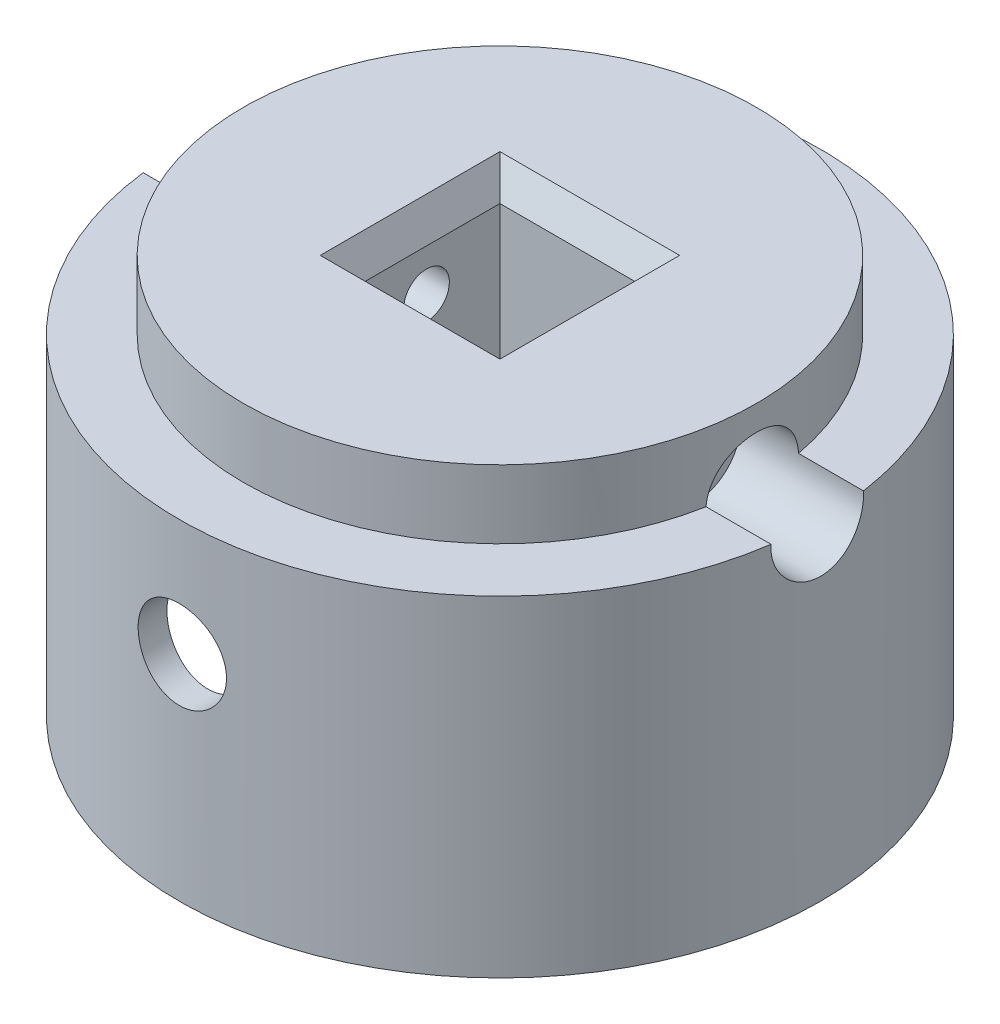
from build123d import *
from OCP.BRepFilletAPI import BRepFilletAPI_MakeChamfer

# Parameters (mm, degrees)
SKETCH1_R                = 22.5
BOSS_EXTRUDE1_DEPTH      = 28
SKETCH2_W                = 10.3
SKETCH2_H                = 10.3
CUT_EXTRUDE2_DEPTH       = 43.385138905
SHELL3_T                 = -2
SKETCH3_R                = 3.1
CUT_EXTRUDE3_DEPTH       = 47.576523056
CHAMFER1_SIZE            = 2
CHAMFER1_SIZE2           = 1.154700538
BOSS_EXTRUDE8_START      = 23
BOSS_EXTRUDE8_DEPTH      = 23
BOSS_EXTRUDE4_DEPTH      = 20
BOSS_EXTRUDE6_DEPTH      = 26
CUT_EXTRUDE5_DEPTH       = 10
SKETCH13_R               = 3.8
CUT_EXTRUDE6_DEPTH       = 16
SKETCH15_W               = 10
SKETCH15_H               = 3
CUT_EXTRUDE8_DEPTH       = 16
CUT_EXTRUDE9_DEPTH       = 2
BOSS_EXTRUDE10_START     = 7
BOSS_EXTRUDE10_DEPTH     = 7
SKETCH21_OUTSIDE_W       = 61.262
SKETCH21_OUTSIDE_H       = 63.966
SKETCH21_OUTSIDE_R       = 18
CUT_EXTRUDE11_DEPTH      = 4.8
CUT_EXTRUDE12_DEPTH      = 47.730672242
CUT_EXTRUDE12_DEPTH_BACK = 47.730672242
SKETCH22_R               = 1.6
CUT_EXTRUDE13_START      = -8.5
SKETCH24_R               = 3.25
CUT_EXTRUDE13_DEPTH      = 39.230672302
CUT_EXTRUDE14_START      = -8.5
CUT_EXTRUDE14_DEPTH      = 39.230672304


with BuildPart() as part:
    # Sketch1 → Boss-Extrude1 (new body)
    with BuildSketch(Plane(origin=(0, 0, 0), x_dir=(1, 0, 0), z_dir=(0, 1, 0))):
        with Locations(Location((0, 0, 0), (0, 0, 270))):
            Circle(SKETCH1_R)
    extrude(amount=BOSS_EXTRUDE1_DEPTH)

    # Sketch2 → Cut-Extrude2 (cut, through all)
    with BuildSketch(Plane.XZ):
        Rectangle(SKETCH2_W, SKETCH2_H)
    extrude(amount=-CUT_EXTRUDE2_DEPTH, mode=Mode.SUBTRACT)

    # Shell3
    shell3_openings = [part.faces().sort_by_distance(p)[0] for p in [
        (0, 0, -21.863603897),
    ]]
    offset(amount=SHELL3_T, openings=shell3_openings, kind=Kind.INTERSECTION)

    # Sketch3 → Cut-Extrude3 (cut, through all)
    with BuildSketch(Plane.XY.offset(7.15)):
        with Locations(Location((0, 15, 0), (0, 0, 270.000000016))):
            Circle(SKETCH3_R)
    extrude(amount=CUT_EXTRUDE3_DEPTH, mode=Mode.SUBTRACT)

    # Chamfer1: one chamfer whose edges measure the first distance from different faces: ONE call of the kernel's chamfer builder (chamfer() names one face for all edges)
    chamfer1_edges_1 = [part.edges().sort_by_distance(p)[0] for p in [
        (5.15, 28, 0),
    ]]
    chamfer1_side_1 = [part.faces().sort_by_distance(p)[0] for p in [
        (5.15, 14, 0),
    ]]
    chamfer1_edges_2 = [part.edges().sort_by_distance(p)[0] for p in [
        (0, 28, -5.15),
    ]]
    chamfer1_side_2 = [part.faces().sort_by_distance(p)[0] for p in [
        (0, 14, -5.15),
    ]]
    chamfer1_edges_3 = [part.edges().sort_by_distance(p)[0] for p in [
        (-5.15, 28, 0),
    ]]
    chamfer1_side_3 = [part.faces().sort_by_distance(p)[0] for p in [
        (-5.15, 14, 0),
    ]]
    chamfer1_edges_4 = [part.edges().sort_by_distance(p)[0] for p in [
        (0, 28, 5.15),
    ]]
    chamfer1_side_4 = [part.faces().sort_by_distance(p)[0] for p in [
        (0, 14, 5.15),
    ]]
    chamfer1 = BRepFilletAPI_MakeChamfer(part.part.solid().wrapped)
    for e in chamfer1_edges_1:
        chamfer1.Add(CHAMFER1_SIZE, CHAMFER1_SIZE2, e.wrapped, chamfer1_side_1[0].wrapped)  # the first distance lies on this face
    for e in chamfer1_edges_2:
        chamfer1.Add(CHAMFER1_SIZE, CHAMFER1_SIZE2, e.wrapped, chamfer1_side_2[0].wrapped)  # the first distance lies on this face
    for e in chamfer1_edges_3:
        chamfer1.Add(CHAMFER1_SIZE, CHAMFER1_SIZE2, e.wrapped, chamfer1_side_3[0].wrapped)  # the first distance lies on this face
    for e in chamfer1_edges_4:
        chamfer1.Add(CHAMFER1_SIZE, CHAMFER1_SIZE2, e.wrapped, chamfer1_side_4[0].wrapped)  # the first distance lies on this face
    add(Compound.cast(chamfer1.Shape()), mode=Mode.REPLACE)

    # Sketch18 → Boss-Extrude8 (add)
    with BuildSketch(Plane.XZ.offset(-26).offset(BOSS_EXTRUDE8_START)):
        with BuildLine():
            Line((-15.72889581, -7.671495069), (-18.425277949, -8.986608509))
            ThreePointArc((-18.425277949, -8.986608509), (-20.471905462, 1.072887103), (-17.384985971, 10.863344917))
            Line((-17.384985971, 10.863344917), (-14.840841683, 9.273587124))
            ThreePointArc((-14.840841683, 9.273587124), (-17.476016858, 0.915879234), (-15.72889581, -7.671495069))
        make_face()
    extrude(amount=-BOSS_EXTRUDE8_DEPTH)

    # Sketch9 → Boss-Extrude4 (add)
    with BuildSketch(Plane.XZ):
        Polygon((2.057061598, -22.405769292), (-16.596699733, -15.192088664), (-17.678751827, -17.990152864), (0.975009504, -25.203833492), align=None)
    extrude(amount=-BOSS_EXTRUDE4_DEPTH)

    # Sketch11 → Boss-Extrude6 (add)
    with BuildSketch(Plane.XZ):
        with BuildLine():
            Line((2.057061598, -22.405769292), (7.15, -7.15))
            Line((7.15, -7.15), (-7.15, -7.15))
            Line((-7.15, -7.15), (-16.596699733, -15.192088664))
            ThreePointArc((-16.596699733, -15.192088664), (-8.115390707, -20.985481497), (2.057061598, -22.405769292))
        make_face()
    extrude(amount=-BOSS_EXTRUDE6_DEPTH)

    # Sketch12 → Cut-Extrude5 (cut)
    with BuildSketch(Plane.XZ):
        with BuildLine():
            Line((3.835926277, -17.077224747), (2.755377072, -20.3139828))
            ThreePointArc((2.755377072, -20.3139828), (-6.94485615, -19.287793369), (-15.072724539, -13.894710323))
            Line((-15.072724539, -13.894710323), (-12.788386178, -11.950025708))
            ThreePointArc((-12.788386178, -11.950025708), (-5.15835992, -16.725347781), (3.835926277, -17.077224747))
        make_face()
    extrude(amount=-CUT_EXTRUDE5_DEPTH, mode=Mode.SUBTRACT)

    # Sketch13 → Cut-Extrude6 (cut)
    with BuildSketch(Plane(origin=(-8.351871161, 0, -21.596993178), x_dir=(-0.9326880665539258, 0, 0.3606840314013081), z_dir=(-0.3606840314013081, 0, -0.9326880665539258))):
        with Locations((0, 10)):
            Circle(SKETCH13_R)
    extrude(amount=-CUT_EXTRUDE6_DEPTH, mode=Mode.SUBTRACT)

    # Sketch15 → Cut-Extrude8 (cut)
    with BuildSketch(Plane(origin=(-8.351871161, 0, -21.596993178), x_dir=(-0.9326880665539258, 0, 0.3606840314013081), z_dir=(-0.3606840314013081, 0, -0.9326880665539258))):
        with Locations((0, 10)):
            Rectangle(SKETCH15_W, SKETCH15_H)
    extrude(amount=-CUT_EXTRUDE8_DEPTH, mode=Mode.SUBTRACT)

    # Sketch17 → Cut-Extrude9 (cut)
    with BuildSketch(Plane.XZ):
        with BuildLine():
            Line((7.15, 7.15), (7.15, -7.15))
            Line((7.15, -7.15), (3.835926277, -17.077224747))
            ThreePointArc((3.835926277, -17.077224747), (-5.15835992, -16.725347781), (-12.788386178, -11.950025708))
            Line((-12.788386178, -11.950025708), (-7.15, -7.15))
            Line((-7.15, -7.15), (-7.15, 7.15))
            Line((-7.15, 7.15), (7.15, 7.15))
        make_face()
    extrude(amount=-CUT_EXTRUDE9_DEPTH, mode=Mode.SUBTRACT)

    # Sketch20 → Boss-Extrude10 (add)
    with BuildSketch(Plane.XZ.offset(-26).offset(BOSS_EXTRUDE10_START)):
        with BuildLine():
            Line((2.755377072, -20.3139828), (7.15, -7.15))
            Line((7.15, -7.15), (7.15, 7.15))
            Line((7.15, 7.15), (-7.15, 7.15))
            Line((-7.15, 7.15), (-7.15, -7.15))
            Line((-7.15, -7.15), (-15.072724539, -13.894710323))
            ThreePointArc((-15.072724539, -13.894710323), (6.94485615, 19.287793369), (2.755377072, -20.3139828))
        make_face()
    extrude(amount=-BOSS_EXTRUDE10_DEPTH)

    # Sketch21 outside → Cut-Extrude11 (cut)
    with BuildSketch(Plane(origin=(0, 28, 0), x_dir=(1, 0, 0), z_dir=(0, 1, 0))):
        with Locations((0, 1.352)):
            Rectangle(SKETCH21_OUTSIDE_W, SKETCH21_OUTSIDE_H)
        with Locations(Location((0, 0, 0), (0, 0, 270))):
            Circle(SKETCH21_OUTSIDE_R, mode=Mode.SUBTRACT)
    extrude(amount=-CUT_EXTRUDE11_DEPTH, mode=Mode.SUBTRACT)

    # Sketch22 → Cut-Extrude12 (cut, two sides: drawn at the far end of the back side and taken through both)
    with BuildSketch(Plane.ZY.offset(-5.15).offset(-CUT_EXTRUDE12_DEPTH_BACK)):
        with Locations((0, 23)):
            Circle(SKETCH22_R)
    extrude(amount=CUT_EXTRUDE12_DEPTH + CUT_EXTRUDE12_DEPTH_BACK, mode=Mode.SUBTRACT)

    # Sketch24 → Cut-Extrude13 (cut, through all)
    with BuildSketch(Plane.ZY.offset(-5.15).offset(CUT_EXTRUDE13_START)):
        with Locations((0, 23)):
            Circle(SKETCH24_R)
    extrude(amount=-CUT_EXTRUDE13_DEPTH, mode=Mode.SUBTRACT)

    # Sketch25 → Cut-Extrude14 (cut, through all)
    with BuildSketch(Plane(origin=(-5.15, 0, 0), x_dir=(0, 0, -1), z_dir=(1, 0, 0)).offset(CUT_EXTRUDE14_START)):
        Polygon((0, 19.893553151), (2.690261887, 21.446776575), (2.690261887, 24.553223425), (0, 26.106446849), (-2.690261887, 24.553223425), (-2.690261887, 21.446776575), align=None)
    extrude(amount=-CUT_EXTRUDE14_DEPTH, mode=Mode.SUBTRACT)


solid = part.part
